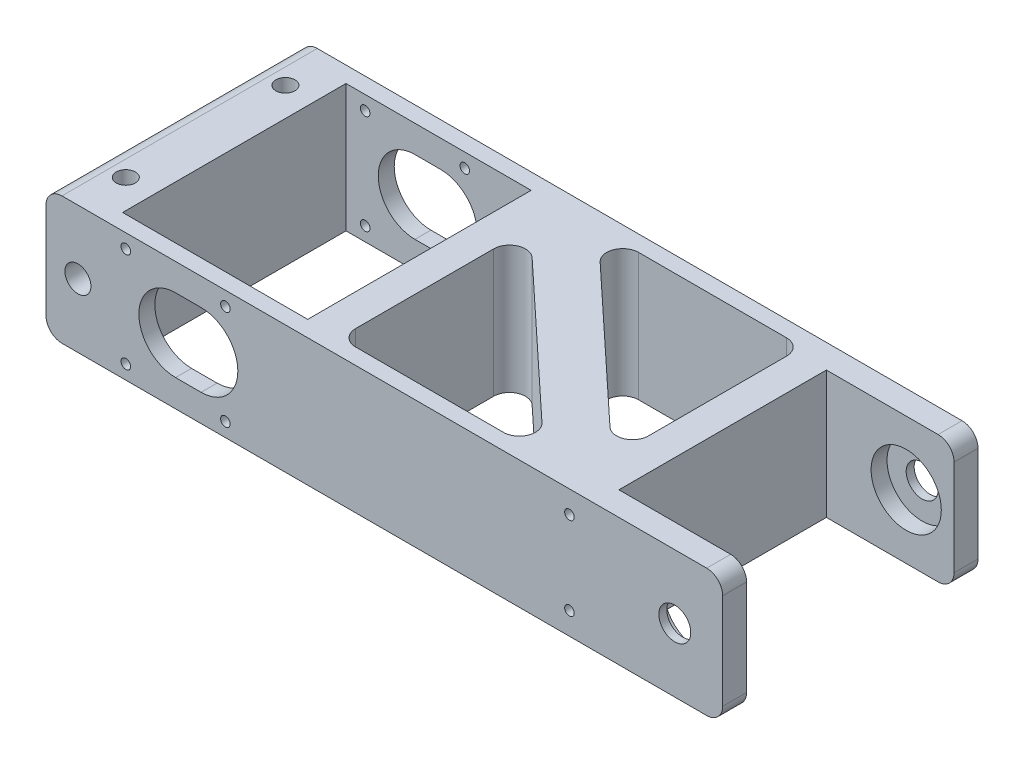
from build123d import *

# Parameters (mm, degrees)
SKETCH1_W               = 212
SKETCH1_H               = 40
SKETCH1_R               = 4.075
SKETCH1_R_2             = 1.5
SKETCH1_R_3             = 5
BOSS_EXTRUDE1_DEPTH     = 40
CUT_EXTRUDE3_DEPTH      = 116.047816146
CUT_EXTRUDE3_DEPTH_BACK = 116.047816146
SKETCH2_R               = 1.5
SKETCH2_W               = 58
SKETCH2_H               = 70
SKETCH2_W_2             = 40
SKETCH2_H_2             = 65
FILLET1_R               = 5
FILLET2_R               = 5
SKETCH4_R               = 11
CUT_EXTRUDE4_DEPTH      = 37.5
SKETCH5_R               = 3
CUT_EXTRUDE5_DEPTH      = 5


with BuildPart() as part:
    # Sketch1 → Boss-Extrude1 (new, symmetric)
    with BuildSketch(Plane.XY):
        Rectangle(SKETCH1_W, SKETCH1_H)
        with Locations((-96, 0)):
            Circle(SKETCH1_R, mode=Mode.SUBTRACT)
        with Locations((-81, 15.6)):
            Circle(SKETCH1_R_2, mode=Mode.SUBTRACT)
        with Locations((-49.8, 15.6)):
            Circle(SKETCH1_R_2, mode=Mode.SUBTRACT)
        with Locations((-81, -15.6)):
            Circle(SKETCH1_R_2, mode=Mode.SUBTRACT)
        with Locations((-49.8, -15.6)):
            Circle(SKETCH1_R_2, mode=Mode.SUBTRACT)
        with Locations((91, 0)):
            Circle(SKETCH1_R_3, mode=Mode.SUBTRACT)
        with Locations((58, 13)):
            Circle(SKETCH1_R_2, mode=Mode.SUBTRACT)
        with Locations((58, -13)):
            Circle(SKETCH1_R_2, mode=Mode.SUBTRACT)
        with BuildLine():
            Line((-65.4, 11.5), (-57.4, 11.5))
            ThreePointArc((-57.4, 11.5), (-45.9, 0), (-57.4, -11.5))
            Line((-57.4, -11.5), (-65.4, -11.5))
            ThreePointArc((-65.4, -11.5), (-76.9, 0), (-65.4, 11.5))
        make_face(mode=Mode.SUBTRACT)
    extrude(amount=BOSS_EXTRUDE1_DEPTH, both=True)

    # Sketch2 → Cut-Extrude3 (cut, two sides: drawn at the far end of the back side and taken through both)
    with BuildSketch(Plane(origin=(0, 0, 0), x_dir=(1, 0, 0), z_dir=(0, 1, 0)).offset(-CUT_EXTRUDE3_DEPTH_BACK)):
        with Locations(Location((-96, 25, 0), (0, 0, 270))):
            Circle(SKETCH2_R)
        with Locations(Location((-96, -25, 0), (0, 0, 270))):
            Circle(SKETCH2_R)
        with Locations((-58, 0)):
            Rectangle(SKETCH2_W, SKETCH2_H)
        Polygon((-19, 24.740857736), (45.00806186, -35), (-19, -35), align=None)
        with Locations((86, 0)):
            Rectangle(SKETCH2_W_2, SKETCH2_H_2)
        Polygon((-8.00806186, 35), (56, -24.740857736), (56, 35), align=None)
    extrude(amount=CUT_EXTRUDE3_DEPTH + CUT_EXTRUDE3_DEPTH_BACK, mode=Mode.SUBTRACT)

    # Fillet1
    fillet1_edges = [part.edges().sort_by_distance(p)[0] for p in [
        (56, 0, -35),
        (56, 0, 24.740857736),
        (-8.00806186, 0, -35),
        (45.00806186, 0, 35),
        (-19, 0, 35),
        (-19, 0, -24.740857736),
    ]]
    fillet(fillet1_edges, radius=FILLET1_R)

    # Fillet2
    fillet2_edges = [part.edges().sort_by_distance(p)[0] for p in [
        (106, -20, 36.25),
        (-106, -20, 0),
        (-106, 20, 0),
        (106, 20, 36.25),
        (106, -20, -36.25),
        (106, 20, -36.25),
    ]]
    fillet(fillet2_edges, radius=FILLET2_R)

    # Sketch4 → Cut-Extrude4 (cut, symmetric)
    with BuildSketch(Plane.XY):
        with Locations((91, 0)):
            Circle(SKETCH4_R)
    extrude(amount=CUT_EXTRUDE4_DEPTH, both=True, mode=Mode.SUBTRACT)

    # Sketch5 → Cut-Extrude5 (cut)
    with BuildSketch(Plane(origin=(0, 20, 0), x_dir=(1, 0, 0), z_dir=(0, 1, 0))):
        with Locations(Location((-96, 25, 0), (0, 0, 270))):
            Circle(SKETCH5_R)
        with Locations(Location((-96, -25, 0), (0, 0, 270))):
            Circle(SKETCH5_R)
    extrude(amount=-CUT_EXTRUDE5_DEPTH, mode=Mode.SUBTRACT)


solid = part.part
